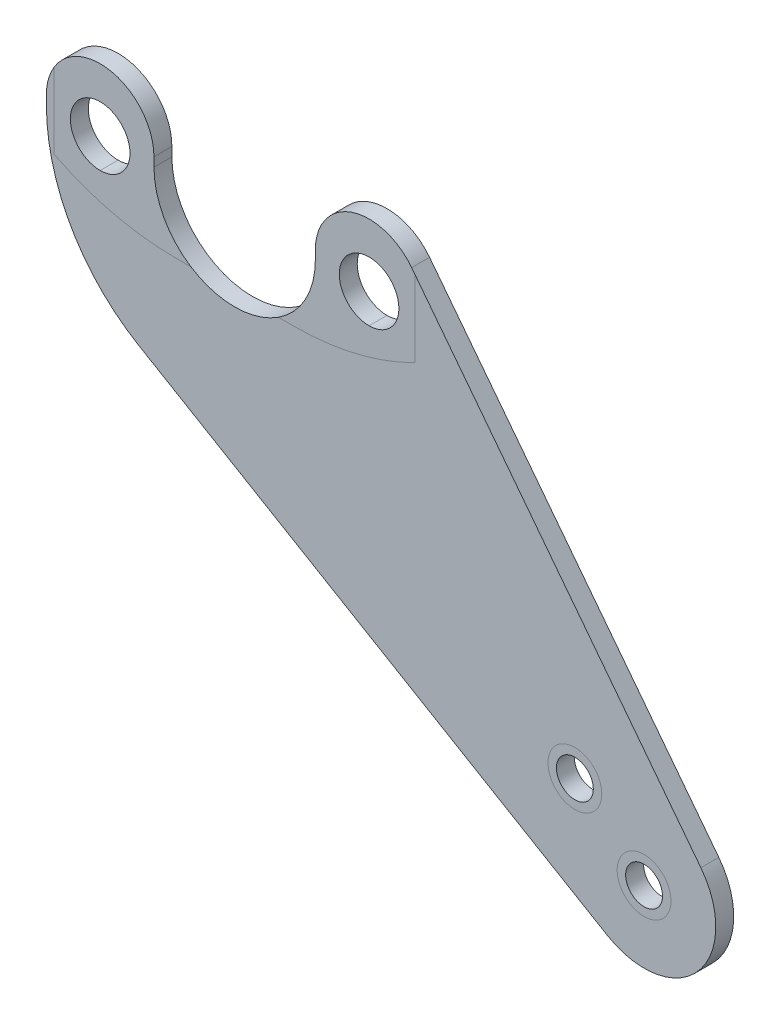
from build123d import *

# Parameters (mm, degrees)
SKETCH1_R           = 5.275384615
SKETCH1_R_2         = 3.2639
BOSS_EXTRUDE1_DEPTH = 3.175


with BuildPart() as part:
    # Sketch1 → Boss-Extrude1 (new body)
    with BuildSketch(Plane.XY):
        with BuildLine():
            Line((-14.2875, 1.5875), (-14.2875, 0))
            ThreePointArc((-14.2875, 0), (0, -14.2875), (14.2875, 0))
            Line((14.2875, 0), (14.2875, 1.5875))
            ThreePointArc((14.2875, 1.5875), (20.740075347, 10.603365557), (31.355391181, 7.403892149))
            Line((31.355391181, 7.403892149), (82.572922645, -59.016709578))
            ThreePointArc((82.572922645, -59.016709578), (82.033512438, -75.180341372), (66.05971387, -77.708525595))
            Line((66.05971387, -77.708525595), (-16.947053899, -28.708644524))
            ThreePointArc((-16.947053899, -28.708644524), (-28.951349844, -16.529012325), (-33.3375, 0))
            Line((-33.3375, 0), (-33.3375, 1.5875))
            ThreePointArc((-33.3375, 1.5875), (-23.8125, 11.1125), (-14.2875, 1.5875))
        make_face()
        with Locations((-23.8125, 0)):
            Circle(SKETCH1_R, mode=Mode.SUBTRACT)
        with Locations((23.8125, 0)):
            Circle(SKETCH1_R, mode=Mode.SUBTRACT)
        with Locations((72.515734403, -66.77189911)):
            Circle(SKETCH1_R_2, mode=Mode.SUBTRACT)
        with Locations((60.259023314, -56.487297355)):
            Circle(SKETCH1_R_2, mode=Mode.SUBTRACT)
    extrude(amount=BOSS_EXTRUDE1_DEPTH)


solid = part.part
